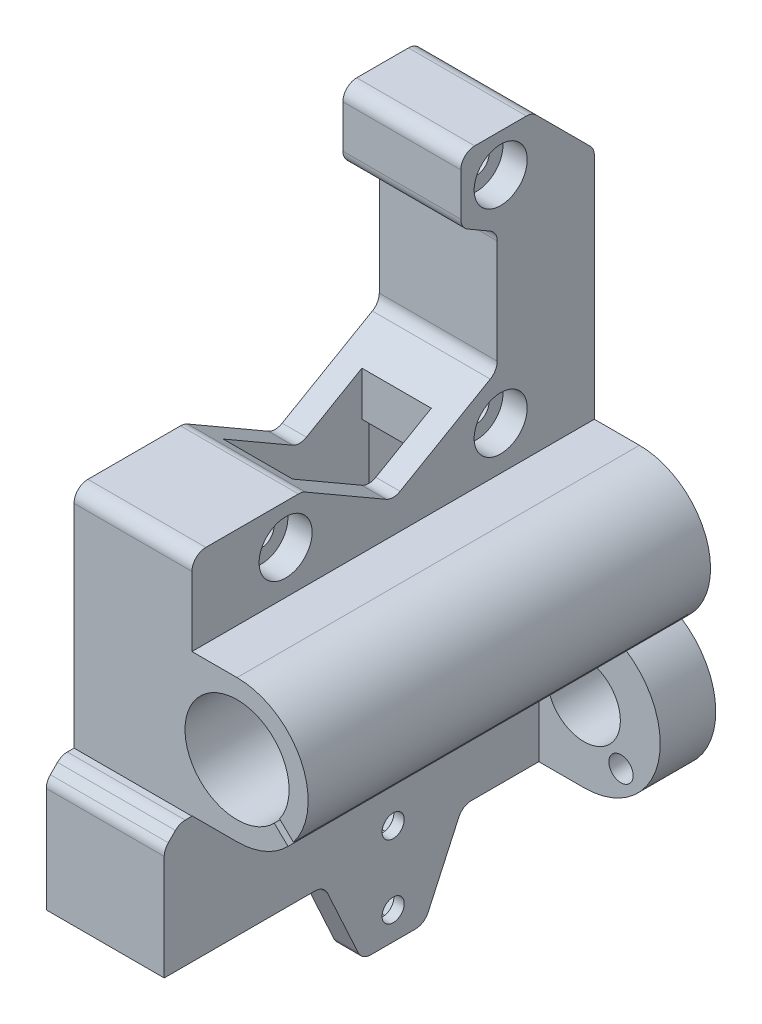
from build123d import *

# Parameters (mm, degrees)
SKETCH1_R           = 1.825
SKETCH1_W           = 26
SKETCH1_H           = 1.5
BOSS_EXTRUDE1_DEPTH = 17
BOSS_EXTRUDE2_DEPTH = 58
BOSS_EXTRUDE4_DEPTH = 3.5
SKETCH9_R           = 7.5
CUT_EXTRUDE5_DEPTH  = 61
SKETCH18_R          = 1.6
CUT_EXTRUDE12_DEPTH = 5.5
CUT_EXTRUDE13_START = 1.5
CUT_EXTRUDE13_DEPTH = 3.5
FILLET1_R           = 2
SKETCH3_W           = 10
SKETCH3_H           = 20
CUT_EXTRUDE1_DEPTH  = 13
CUT_EXTRUDE2_DEPTH  = 42
SKETCH5_R           = 3.825
SKETCH5_R_2         = 9.1924e-05
CUT_EXTRUDE3_DEPTH  = 3.5
CUT_EXTRUDE4_DEPTH  = 38
SKETCH11_R          = 5.25
BOSS_EXTRUDE3_DEPTH = 8
CUT_EXTRUDE6_DEPTH  = 57
SKETCH12_R          = 1.75
CUT_EXTRUDE9_DEPTH  = 10
CUT_EXTRUDE10_DEPTH = 3
SKETCH20_R          = 4.738046486
CUT_EXTRUDE14_DEPTH = 5


with BuildPart() as part:
    # Sketch1 → Boss-Extrude1 (new body)
    with BuildSketch(Plane(origin=(50, 0, 0), x_dir=(0, 0, -1), z_dir=(1, 0, 0))):
        Polygon((-62, -12.5), (-59.799999237, -10.300000191), (-58, -10.300000191), (-58, 22.251573162), (-42.115229422, 22.251573162), (-29, 14.679491924), (-14, 23.339745962), (-14, 40.660254038), (-19.243964356, 43.68785827), (-19.243964356, 53), (-8.961172368, 53), (0, 44.038826034), (0, -28.5), (-62, -28.5), align=None)
        with Locations((-44.5, 16.5)):
            Circle(SKETCH1_R, mode=Mode.SUBTRACT)
        with Locations((-13.5, 16.5)):
            Circle(SKETCH1_R, mode=Mode.SUBTRACT)
        with Locations((-13.5, 47.5)):
            Circle(SKETCH1_R, mode=Mode.SUBTRACT)
        with Locations((-29, -11.75)):
            Rectangle(SKETCH1_W, SKETCH1_H, mode=Mode.SUBTRACT)
    extrude(amount=BOSS_EXTRUDE1_DEPTH)

    # Sketch8 → Boss-Extrude2 (add)
    with BuildSketch(Plane.XY.offset(58)):
        with BuildLine():
            ThreePointArc((73.5, -10.25), (83.75, 0), (73.5, 10.25))
            Line((73.5, 10.25), (67, 10.25))
            Line((67, 10.25), (67, -10.25))
            Line((67, -10.25), (73.5, -10.25))
        make_face()
    extrude(amount=-BOSS_EXTRUDE2_DEPTH)

    # Sketch17 → Boss-Extrude4 (add)
    with BuildSketch(Plane(origin=(67, 0, 0), x_dir=(0, 0, -1), z_dir=(1, 0, 0))):
        Polygon((-33.5, -40.5), (-39, -28.5), (-19, -28.5), (-24.5, -40.5), align=None)
    extrude(amount=-BOSS_EXTRUDE4_DEPTH)

    # Sketch9 → Cut-Extrude5 (cut)
    with BuildSketch(Plane.XY.offset(58)):
        with Locations((73.5, 0)):
            Circle(SKETCH9_R)
    extrude(amount=-CUT_EXTRUDE5_DEPTH, mode=Mode.SUBTRACT)

    # Sketch18 → Cut-Extrude12 (cut)
    with BuildSketch(Plane(origin=(67, 0, 0), x_dir=(0, 0, -1), z_dir=(1, 0, 0))):
        with Locations((-29, -36.5)):
            Circle(SKETCH18_R)
        with Locations((-29, -26)):
            Circle(SKETCH18_R)
    extrude(amount=-CUT_EXTRUDE12_DEPTH, mode=Mode.SUBTRACT)

    # Sketch19 → Cut-Extrude13 (cut)
    with BuildSketch(Plane.ZY.offset(-67).offset(CUT_EXTRUDE13_START)):
        Polygon((30.760918321, -33.45), (27.239081679, -33.45), (25.478163358, -36.5), (27.239081679, -39.55), (30.760918321, -39.55), (32.521836642, -36.5), align=None)
        Polygon((32.521836642, -26), (30.760918321, -22.95), (27.239081679, -22.95), (25.478163358, -26), (27.239081679, -29.05), (30.760918321, -29.05), align=None)
    extrude(amount=CUT_EXTRUDE13_DEPTH, mode=Mode.SUBTRACT)

    # Fillet1
    fillet1_edges = [part.edges().sort_by_distance(p)[0] for p in [
        (58.5, -12.5, 62),
        (58.5, -10.300000191, 59.799999237),
        (58.5, 22.251573162, 58),
        (58.5, 22.251573162, 42.115229422),
        (58.5, 14.679491924, 29),
        (58.5, 23.339745962, 14),
        (58.5, 40.660254038, 14),
        (58.5, 43.68785827, 19.243964356),
        (58.5, 53, 19.243964356),
        (58.5, 53, 8.961172368),
        (58.5, 44.038826034, 0),
        (65.25, -40.5, 24.5),
        (65.25, -40.5, 33.5),
        (65.25, -28.5, 39),
        (65.25, -28.5, 19),
    ]]
    fillet(fillet1_edges, radius=FILLET1_R)

    # Sketch3 → Cut-Extrude1 (cut)
    with BuildSketch(Plane(origin=(0, 22.251573162, 0), x_dir=(1, 0, 0), z_dir=(0, 1, 0))):
        with Locations((58.5, -30)):
            Rectangle(SKETCH3_W, SKETCH3_H)
    extrude(amount=-CUT_EXTRUDE1_DEPTH, mode=Mode.SUBTRACT)

    # Sketch4 → Cut-Extrude2 (cut)
    with BuildSketch(Plane.XZ.offset(28.5)):
        Polygon((53.5, 19), (56.571100235, 16), (60.5, 16), (63.5, 19.071100235), (63.5, 36), (61.454799652, 42), (55.545200348, 42), (53.5, 36), align=None)
    extrude(amount=-CUT_EXTRUDE2_DEPTH, mode=Mode.SUBTRACT)

    # Sketch5 → Cut-Extrude3 (cut)
    # profile 1 of 3: a face of its own
    with BuildSketch(Plane(origin=(67, 0, 0), x_dir=(0, 0, -1), z_dir=(1, 0, 0))):
        with Locations((-13.5, 16.5)):
            Circle(SKETCH5_R)
    # profile 2 of 3: a face of its own
    with BuildSketch(Plane(origin=(67, 0, 0), x_dir=(0, 0, -1), z_dir=(1, 0, 0))):
        with Locations((-44.5, 16.5)):
            Circle(SKETCH5_R)
    # profile 3 of 3: a face of its own
    with BuildSketch(Plane(origin=(67, 0, 0), x_dir=(0, 0, -1), z_dir=(1, 0, 0))):
        with Locations((-13.5, 47.5)):
            Circle(SKETCH5_R)
        with Locations((-13.5, 47.5)):
            Circle(SKETCH5_R_2, mode=Mode.SUBTRACT)
    extrude(amount=-CUT_EXTRUDE3_DEPTH, mode=Mode.SUBTRACT)

    # Sketch7 → Cut-Extrude4 (cut)
    with BuildSketch(Plane.XZ.offset(28.5)):
        with BuildLine():
            Line((56.751731208, 54.680921248), (57.129943038, 55.738046486))
            Line((57.129943038, 55.738046486), (59.920023802, 55.738046486))
            Line((59.920023802, 55.738046486), (60.269111237, 54.670949527))
            ThreePointArc((60.269111237, 54.670949527), (58.488447481, 46.925016376), (56.751731208, 54.680921248))
        make_face()
        with BuildLine():
            Line((56.751731208, 9.680921248), (57.129943038, 10.738046486))
            Line((57.129943038, 10.738046486), (59.920023802, 10.738046486))
            Line((59.920023802, 10.738046486), (60.269111237, 9.670949527))
            ThreePointArc((60.269111237, 9.670949527), (58.488447481, 1.925016376), (56.751731208, 9.680921248))
        make_face()
    extrude(amount=-CUT_EXTRUDE4_DEPTH, mode=Mode.SUBTRACT)

    # Sketch11 → Boss-Extrude3 (add)
    with BuildSketch(Plane(origin=(0, 0, 0), x_dir=(-1, 0, 0), z_dir=(0, 0, -1))):
        with BuildLine():
            Line((-73.5, -28.5), (-67, -28.5))
            Line((-67, -28.5), (-67, -7.732421496))
            Line((-67, -7.732421496), (-78.559091832, -7.732421496))
            ThreePointArc((-78.559091832, -7.732421496), (-84.18745441, -20.103520353), (-73.5, -28.5))
        make_face()
        with Locations(Location((-73.5, -17.5, 0), (0, 0, 90))):
            Circle(SKETCH11_R, mode=Mode.SUBTRACT)
    extrude(amount=-BOSS_EXTRUDE3_DEPTH)

    # Sketch10 → Cut-Extrude6 (cut)
    with BuildSketch(Plane.XY.offset(58)):
        Polygon((81.072283805, -7.35323434), (78.440260846, -4.840560214), (79.279772993, -3.982978679), (81.857582145, -6.443897318), align=None)
    extrude(amount=-CUT_EXTRUDE6_DEPTH, mode=Mode.SUBTRACT)

    # Sketch12 → Cut-Extrude9 (cut)
    with BuildSketch(Plane(origin=(0, 0, 0), x_dir=(-1, 0, 0), z_dir=(0, 0, -1))):
        with Locations(Location((-68.16033141, -11.542824549, 0), (0, 0, 90))):
            Circle(SKETCH12_R)
        with Locations(Location((-78.83966859, -23.457175451, 0), (0, 0, 90))):
            Circle(SKETCH12_R)
    extrude(amount=-CUT_EXTRUDE9_DEPTH, mode=Mode.SUBTRACT)

    # Sketch13 → Cut-Extrude10 (cut)
    with BuildSketch(Plane.XY.offset(8)):
        Polygon((82.389929098, -23.513303191), (80.663406893, -20.410623531), (77.113146384, -20.354495791), (75.289408081, -23.401047711), (77.015930287, -26.503727371), (80.566190795, -26.559855111), align=None)
        Polygon((67.351855423, -15.000260966), (70.750321186, -13.971703501), (71.558797173, -10.514267084), (68.968807398, -8.085388132), (65.570341635, -9.113945597), (64.761865648, -12.571382014), align=None)
    extrude(amount=CUT_EXTRUDE10_DEPTH, mode=Mode.SUBTRACT)

    # Sketch20 → Cut-Extrude14 (cut)
    with BuildSketch(Plane.XZ.offset(-9.5)):
        with Locations((58.5, 6)):
            Circle(SKETCH20_R)
        with Locations((58.5, 51)):
            Circle(SKETCH20_R)
    extrude(amount=CUT_EXTRUDE14_DEPTH, mode=Mode.SUBTRACT)


solid = part.part
